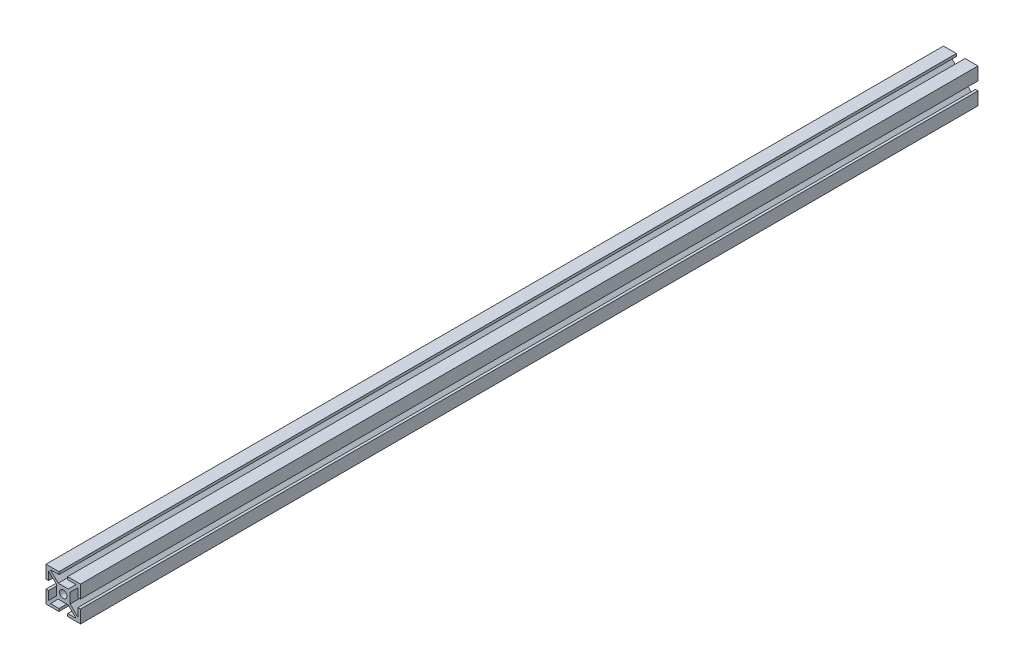
from build123d import *

# Parameters (mm, degrees)
SKIZZE2_R                       = 2.15
AUFSATZ_LINEAR_AUSTRAGEN1_DEPTH = 520


with BuildPart() as part:
    # Skizze2 → Aufsatz-Linear austragen1 (new body)
    with BuildSketch(Plane.XY):
        Polygon((-10, -2.5), (-10, -10), (-2.5, -10), (-2.5, -8.5), (-7.439339828, -8.5), (-2.939339828, -4), (2.939339828, -4), (7.439339828, -8.5), (2.5, -8.5), (2.5, -10), (10, -10), (10, -2.5), (8.495523259, -2.5), (8.495523259, -7.434863087), (4, -2.939339828), (4, 2.939339828), (8.495523259, 7.434863087), (8.495523259, 2.5), (10, 2.5), (10, 10), (2.5, 10), (2.5, 8.5), (7.439339828, 8.5), (2.939339828, 4), (-2.939339828, 4), (-7.439339828, 8.5), (-2.5, 8.5), (-2.5, 10), (-10, 10), (-10, 2.5), (-8.5, 2.5), (-8.5, 7.439339828), (-4, 2.939339828), (-4, -2.939339828), (-8.5, -7.439339828), (-8.5, -2.5), align=None)
        Circle(SKIZZE2_R, mode=Mode.SUBTRACT)
    extrude(amount=AUFSATZ_LINEAR_AUSTRAGEN1_DEPTH)


solid = part.part
